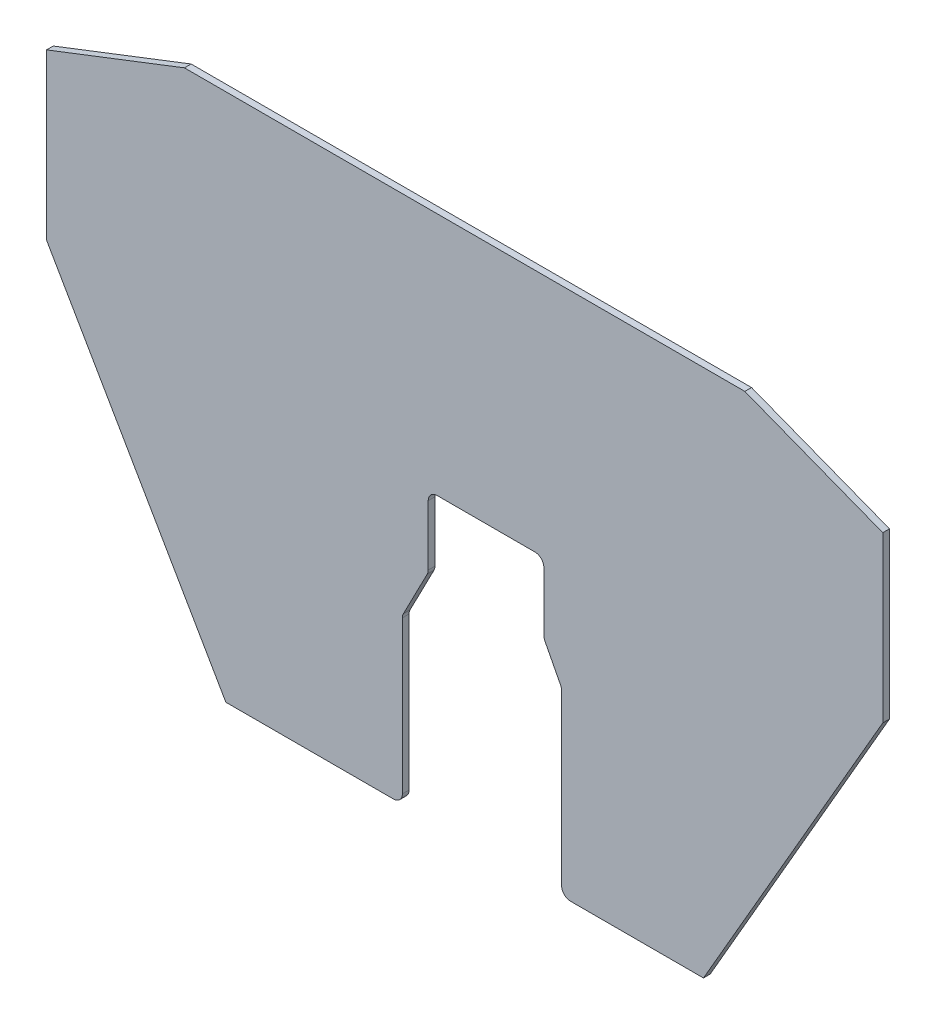
from build123d import *

# Parameters (mm, degrees)
BOSS_EXTRUDE1_DEPTH = 4.7752
FILLET1_R           = 6.35


with BuildPart() as part:
    # Sketch1 → Boss-Extrude1 (new body)
    with BuildSketch(Plane.XY):
        Polygon((170.467651581, -171.615744818), (69.239557334, -171.615744818), (69.239557334, -43.011155522), (56.539557334, -18.443630812), (56.539557334, 31.584255182), (50.8, 31.584255182), (-26.010442666, 31.584255182), (-26.010442666, -19.215744818), (-44.45, -54.886160601), (-44.45, -171.615744818), (-63.5, -171.615744818), (-170.467651581, -171.615744818), (-298.45, 50.056185115), (-298.45, 167.681366782), (-200.025, 205.781366782), (-63.5, 205.781366782), (63.5, 205.781366782), (200.025, 205.781366782), (298.45, 167.681366782), (298.45, 50.056185115), align=None)
    extrude(amount=BOSS_EXTRUDE1_DEPTH)

    # Fillet1
    fillet1_edges = [part.edges().sort_by_distance(p)[0] for p in [
        (69.239557334, -171.615744818, 2.3876),
        (69.239557334, -43.011155522, 2.3876),
        (56.539557334, -18.443630812, 2.3876),
        (56.539557334, 31.584255182, 2.3876),
        (-26.010442666, 31.584255182, 2.3876),
        (-26.010442666, -19.215744818, 2.3876),
        (-44.45, -54.886160601, 2.3876),
        (-44.45, -171.615744818, 2.3876),
    ]]
    fillet(fillet1_edges, radius=FILLET1_R)


solid = part.part
